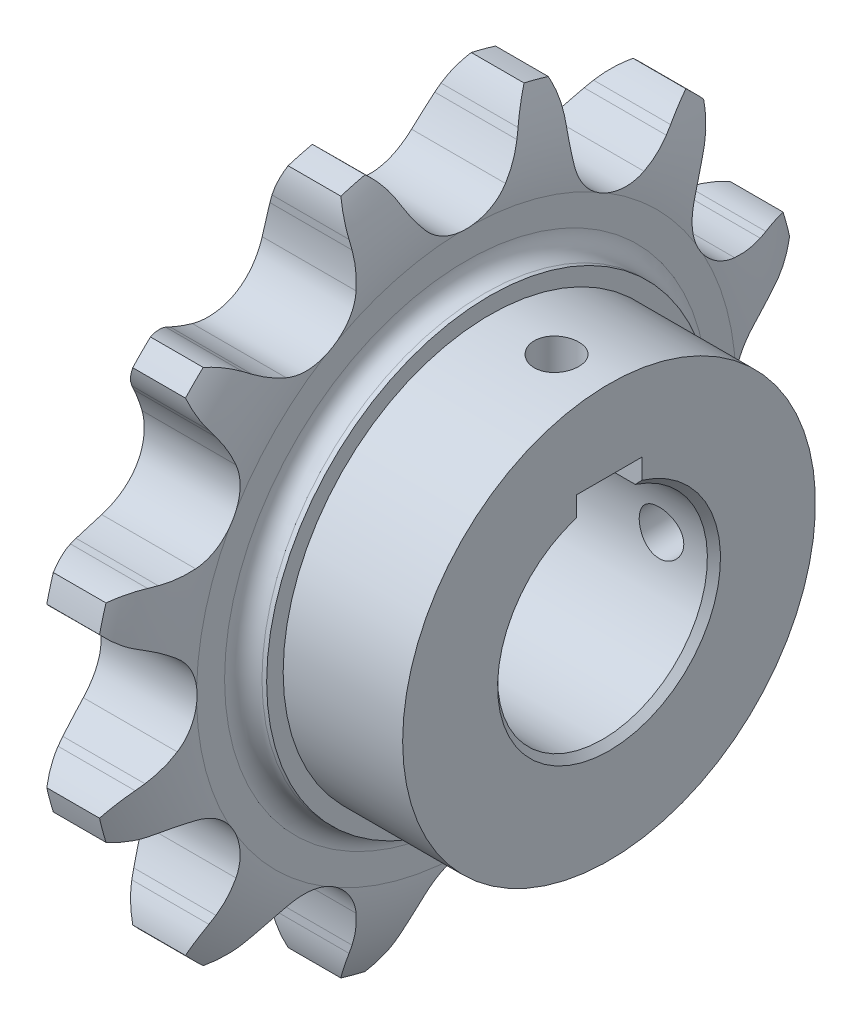
from build123d import *

# Parameters (mm, degrees)
CUT_EXTRUDE_1_DEPTH      = 10.888265988
PATTERN_CIRCULAR_1_COUNT = 12
SKETCH_3_W               = 18.223468024
SKETCH_3_H               = 15.48138064
SKETCH_4_W               = 10
SKETCH_4_H               = 4.101315846
CUT_EXTRUDE_2_DEPTH      = 85.488035852
CHAMFER_1_SIZE           = 1
CHAMFER_3_SIZE           = 1
SKETCH_8_W               = 3.4
SKETCH_8_H               = 52.622372529
PATTERN_CIRCULAR_2_COUNT = 2
PATTERN_CIRCULAR_2_ANGLE = 90


with BuildPart() as part:
    # 草图1 → 旋转1 (revolve)
    with BuildSketch(Plane.XY, mode=Mode.PRIVATE) as revolve_1_sk:
        with BuildLine():
            Line((-10.888265988, 16), (-10.888265988, 34))
            Line((-10.888265988, 34), (-10.17536279, 34))
            ThreePointArc((-10.17536279, 34), (-8.158968049, 34.835218049), (-7.32375, 36.85161279))
            Line((-7.32375, 36.85161279), (-7.32375, 41.129031975))
            ThreePointArc((-7.32375, 41.129031975), (-6.529327244, 47.784267762), (-4.02175, 54))
            Line((-4.02175, 54), (4.02175, 54))
            ThreePointArc((4.02175, 54), (6.529327244, 47.784267762), (7.32375, 41.129031975))
            Line((7.32375, 41.129031975), (7.32375, 36.85161279))
            ThreePointArc((7.32375, 36.85161279), (8.158968049, 34.835218049), (10.17536279, 34))
            Line((10.17536279, 34), (10.888265988, 34))
            Line((10.888265988, 34), (10.888265988, 16))
            Line((10.888265988, 16), (-10.888265988, 16))
        make_face()
    revolve(revolve_1_sk.sketch.rotate(Axis((-12.7, 0, 0), (1, 0, 0)), 90), axis=Axis((-12.7, 0, 0), (1, 0, 0)))

    # 草图2 → 切除-拉伸1 (cut, symmetric)
    with BuildSketch(Plane(origin=(0, 0, 0), x_dir=(0, 0, -1), z_dir=(1, 0, 0))):
        with BuildLine():
            Line((8.796482469, 47.929738206), (9.35516364, 49.042163878))
            ThreePointArc((9.35516364, 49.042163878), (10.564926683, 50.965449982), (12.119649724, 52.622372529))
            ThreePointArc((12.119649724, 52.622372529), (0, 54), (-12.119649724, 52.622372529))
            ThreePointArc((-12.119649724, 52.622372529), (-10.564926683, 50.965449982), (-9.35516364, 49.042163878))
            Line((-9.35516364, 49.042163878), (-8.796482469, 47.929738206))
            ThreePointArc((-8.796482469, 47.929738206), (-7.59092503, 45.84165147), (-6.151107065, 43.907640306))
            ThreePointArc((-6.151107065, 43.907640306), (0, 41.039331975), (6.151107065, 43.907640306))
            ThreePointArc((6.151107065, 43.907640306), (7.59092503, 45.84165147), (8.796482469, 47.929738206))
        make_face()
    cut_extrude_1 = extrude(amount=CUT_EXTRUDE_1_DEPTH, both=True, mode=Mode.SUBTRACT)

    # 阵列(圆周)1: 切除-拉伸1 ×12 about axis
    pattern_circular_1_axis = Axis((0, 0, 0), (1, 0, 0))
    for i in range(1, PATTERN_CIRCULAR_1_COUNT):
        add(cut_extrude_1.rotate(pattern_circular_1_axis, i * 360 / PATTERN_CIRCULAR_1_COUNT), mode=Mode.SUBTRACT)

    # 草图3 → 旋转2 (revolve)
    with BuildSketch(Plane.XY, mode=Mode.PRIVATE) as revolve_2_sk:
        with Locations((20, 23.74069032)):
            Rectangle(SKETCH_3_W, SKETCH_3_H)
    revolve(revolve_2_sk.sketch.rotate(Axis((0, 0, 0), (1, 0, 0)), 90), axis=Axis((0, 0, 0), (1, 0, 0)))

    # 草图4 → 切除-拉伸2 (cut, through all)
    with BuildSketch(Plane.ZY.offset(10.888265988)):
        with Locations((0, 17.249342077)):
            Rectangle(SKETCH_4_W, SKETCH_4_H)
    extrude(amount=-CUT_EXTRUDE_2_DEPTH, mode=Mode.SUBTRACT)

    # 倒角1
    chamfer_1_edges = [part.edges().sort_by_distance(p)[0] for p in [
        (-10.888265988, -16, 0),
    ]]
    chamfer(chamfer_1_edges, length=CHAMFER_1_SIZE)

    # 倒角3
    chamfer_3_edges = [part.edges().sort_by_distance(p)[0] for p in [
        (29.111734012, -16, 0),
    ]]
    chamfer(chamfer_3_edges, length=CHAMFER_3_SIZE)

    # 草图8 → M8x1.25 螺纹孔1 (revolve, cut)
    with BuildSketch(Plane(origin=(21.111734012, 0, 0), x_dir=(0, 0, -1), z_dir=(1, 0, 0))):
        with Locations((1.7, 26.311186265)):
            Rectangle(SKETCH_8_W, SKETCH_8_H)
    m8x1_25_1 = revolve(axis=Axis((21.111734012, -6.35, 0), (0, 1, 0)), mode=Mode.SUBTRACT)

    # 阵列(圆周)2: M8x1.25 螺纹孔1 ×2 about axis
    pattern_circular_2_axis = Axis((-12.7, 0, 0), (-1, 0, 0))
    for i in range(1, PATTERN_CIRCULAR_2_COUNT):
        add(m8x1_25_1.rotate(pattern_circular_2_axis, i * PATTERN_CIRCULAR_2_ANGLE / (PATTERN_CIRCULAR_2_COUNT - 1)), mode=Mode.SUBTRACT)


solid = part.part
